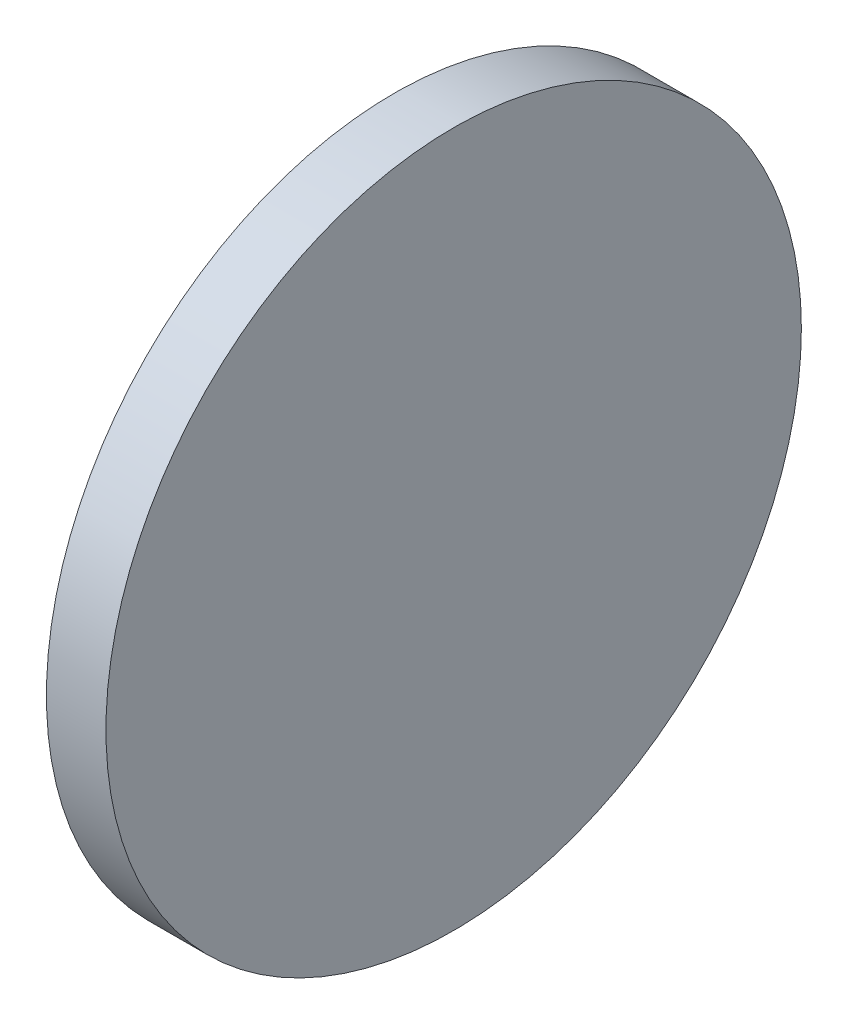
from build123d import *


with BuildPart() as part:
    # Эскиз1 → Повернуть1 (revolve)
    with BuildSketch(Plane(origin=(0, 0, 0), x_dir=(1, 0, 0), z_dir=(0, 1, 0))):
        with BuildLine():
            Line((-10.029852788, 0), (-10.029852788, 10))
            Line((-10.029852788, 10), (-11.742167966, 10))
            ThreePointArc((-11.742167966, 10), (-13.450638335, 5.129169081), (-14.029852788, 0))
            Line((-14.029852788, 0), (-10.029852788, 0))
        make_face()
    revolve(axis=Axis((0, 0, 0), (-1, 0, 0)))


solid = part.part
